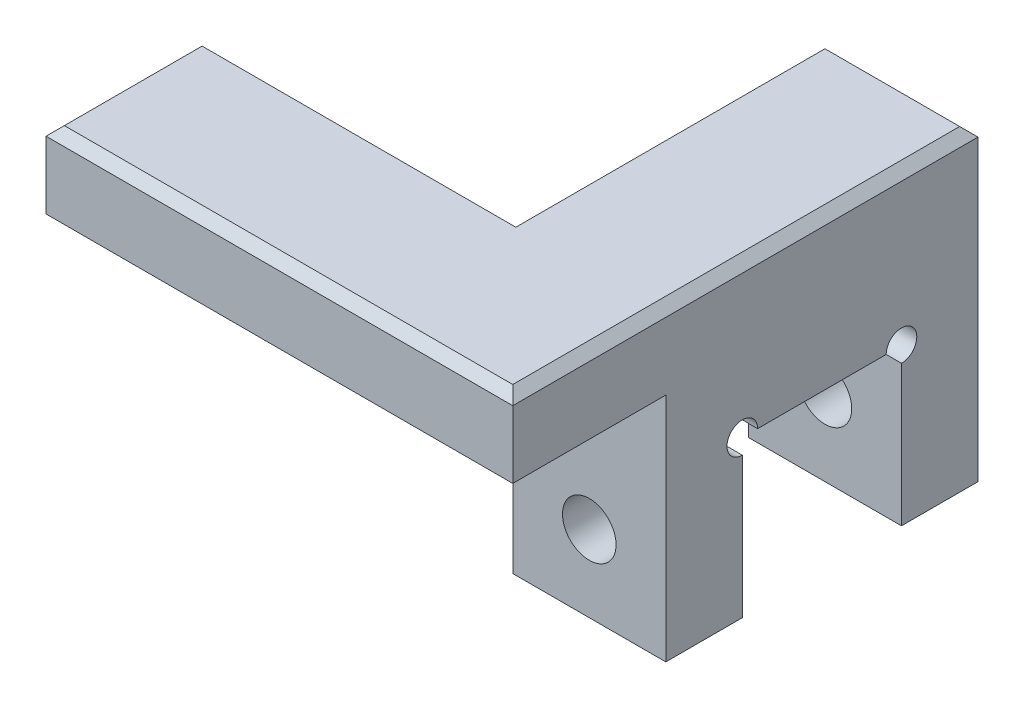
from build123d import *

# Parameters (mm, degrees)
EXTRUDE_1_DEPTH          = 10
CUT_EXTRUDE_1_DEPTH      = 25.822570375
CUT_EXTRUDE_1_DEPTH_BACK = 25.822570375
SKETCH_2_R               = 1.75
EXTRUDE_2_DEPTH          = 5
SKETCH_4_R               = 3.2
CUT_EXTRUDE_2_DEPTH      = 2.6
SKETCH_5_R               = 1
CUT_EXTRUDE_3_DEPTH      = 33.45442959
CHAMFER_1_SIZE           = 0.6


with BuildPart() as part:
    # ｽｹｯﾁ1 → ﾎﾞｽ - 押し出し1 (new body)
    with BuildSketch(Plane(origin=(0, 0, 0), x_dir=(0, 0, -1), z_dir=(1, 0, 0))):
        Polygon((-10.2, 10), (-10.2, -5.1), (-5.2, -5.1), (-5.2, 5.1), (5.2, 5.1), (5.2, -5.1), (10.2, -5.1), (10.2, 10), align=None)
    extrude(amount=EXTRUDE_1_DEPTH)

    # ｽｹｯﾁ2 → ｶｯﾄ - 押し出し1 (cut, two sides: drawn at the far end of the back side and taken through both)
    with BuildSketch(Plane.XY.offset(10.2).offset(-CUT_EXTRUDE_1_DEPTH_BACK)):
        with Locations((5, -0.1)):
            Circle(SKETCH_2_R)
    extrude(amount=CUT_EXTRUDE_1_DEPTH + CUT_EXTRUDE_1_DEPTH_BACK, mode=Mode.SUBTRACT)

    # ｽｹｯﾁ3 → ﾎﾞｽ - 押し出し2 (add)
    with BuildSketch(Plane(origin=(0, 10, 0), x_dir=(1, 0, 0), z_dir=(0, 1, 0))):
        Polygon((10, -10.2), (10, -20.2), (-20.5, -20.2), (-20.5, -10), (0, -10), (0, 10.2), (10, 10.2), align=None)
    extrude(amount=EXTRUDE_2_DEPTH)

    # ｽｹｯﾁ4 → ｶｯﾄ - 押し出し2 (cut)
    with BuildSketch(Plane.XZ.offset(-10)):
        with Locations(Location((-10.25, 15.1, 0), (0, 0, 270))):
            Circle(SKETCH_4_R)
    extrude(amount=-CUT_EXTRUDE_2_DEPTH, mode=Mode.SUBTRACT)

    # ｽｹｯﾁ5 → ｶｯﾄ - 押し出し3 (cut, through all)
    with BuildSketch(Plane.ZY):
        with Locations((5.2, 5.1)):
            Circle(SKETCH_5_R)
        with Locations((-5.2, 5.1)):
            Circle(SKETCH_5_R)
    extrude(amount=-CUT_EXTRUDE_3_DEPTH, mode=Mode.SUBTRACT)

    # 面取り1
    chamfer_1_edges = [part.edges().sort_by_distance(p)[0] for p in [
        (10, 15, 5),
        (5, 15, -10.2),
        (0, 15, -0.1),
        (-10.25, 15, 10),
        (-20.5, 15, 15.1),
        (-5.25, 15, 20.2),
    ]]
    chamfer(chamfer_1_edges, length=CHAMFER_1_SIZE)


solid = part.part
